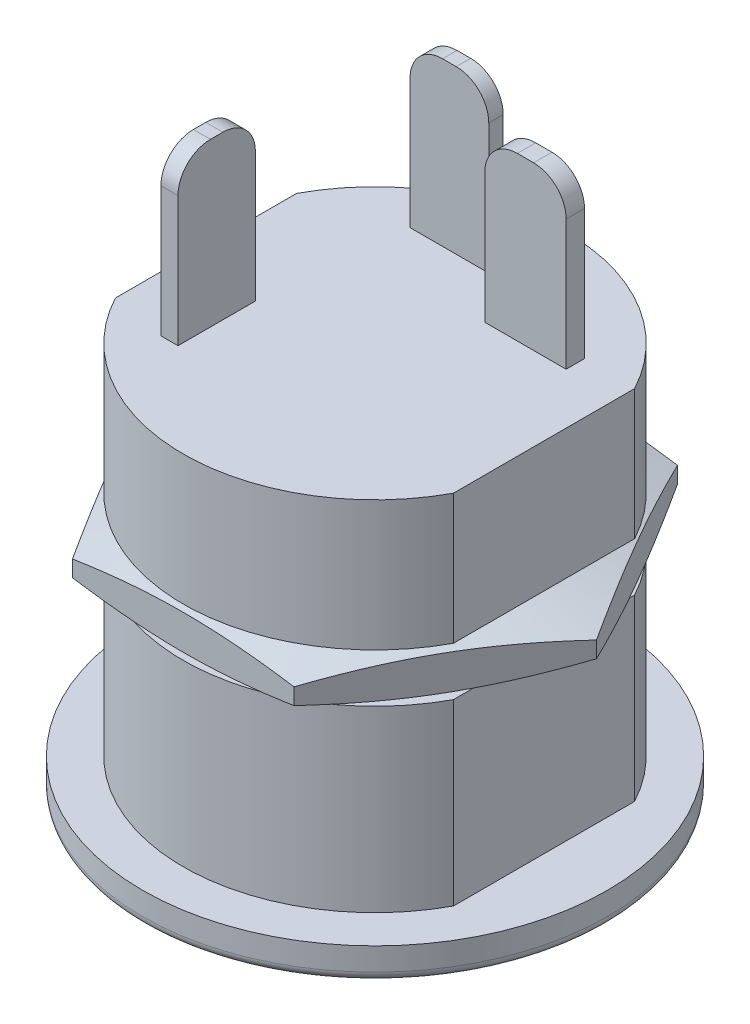
from build123d import *

# Parameters (mm, degrees)
SKETCH_2_R          = 5.9
EXTRUDE_1_DEPTH     = 11
SKETCH_3_R          = 7.15
EXTRUDE_2_DEPTH     = 1
SKETCH_4_R          = 3.1
SKETCH_4_R_2        = 0.5
CUT_EXTRUDE_1_DEPTH = 5
FILLET_1_R          = 0.3
FILLET_2_R          = 0.3
SKETCH_5_W          = 16.4
SKETCH_5_H          = 21
SKETCH_5_W_2        = 10.4
SKETCH_5_H_2        = 15
CUT_EXTRUDE_2_DEPTH = 11
SKETCH_6_W          = 2.420538387
SKETCH_6_H          = 0.443765371
SKETCH_6_W_2        = 2.501222999
SKETCH_6_H_2        = 0.56479229
SKETCH_6_W_3        = 0.524449984
SKETCH_6_H_3        = 2.38019608
EXTRUDE_3_DEPTH     = 5
FILLET_3_R          = 1
EXTRUDE_START       = -4
EXTRUDE_4_DEPTH     = 1.5


with BuildPart() as part:
    # 草图2 → 凸台-拉伸1 (new body)
    with BuildSketch(Plane(origin=(0, 0, 0), x_dir=(1, 0, 0), z_dir=(0, 1, 0))):
        with Locations(Location((0, 0, 0), (0, 0, 270))):
            Circle(SKETCH_2_R)
    extrude(amount=EXTRUDE_1_DEPTH)

    # 草图3 → 凸台-拉伸2 (add)
    with BuildSketch(Plane.XZ):
        with Locations(Location((0, 0, 0), (0, 0, 270))):
            Circle(SKETCH_3_R)
    extrude(amount=EXTRUDE_2_DEPTH)

    # 草图4 → 切除-拉伸1 (cut)
    with BuildSketch(Plane.XZ.offset(1)):
        with Locations(Location((0, 2.5, 0), (0, 0, 270))):
            Circle(SKETCH_4_R)
        with Locations(Location((0, 2.5, 0), (0, 0, 270))):
            Circle(SKETCH_4_R_2, mode=Mode.SUBTRACT)
    extrude(amount=-CUT_EXTRUDE_1_DEPTH, mode=Mode.SUBTRACT)

    # 圆角1
    fillet_1_edges = [part.edges().sort_by_distance(p)[0] for p in [
        (0, -1, 3),
    ]]
    fillet(fillet_1_edges, radius=FILLET_1_R)

    # 圆角2
    fillet_2_edges = [part.edges().sort_by_distance(p)[0] for p in [
        (0, -1, 7.15),
    ]]
    fillet(fillet_2_edges, radius=FILLET_2_R)

    # 草图5 → 切除-拉伸2 (cut)
    with BuildSketch(Plane(origin=(0, 11, 0), x_dir=(1, 0, 0), z_dir=(0, 1, 0))):
        Rectangle(SKETCH_5_W, SKETCH_5_H)
        Rectangle(SKETCH_5_W_2, SKETCH_5_H_2, mode=Mode.SUBTRACT)
    extrude(amount=-CUT_EXTRUDE_2_DEPTH, mode=Mode.SUBTRACT)

    # 草图6 → 凸台-拉伸3 (add)
    with BuildSketch(Plane(origin=(0, 11, 0), x_dir=(1, 0, 0), z_dir=(0, 1, 0))):
        with Locations((-1.331296113, 3.842604689)):
            Rectangle(SKETCH_6_W, SKETCH_6_H)
        with Locations((2.38019608, 2.531479729)):
            Rectangle(SKETCH_6_W_2, SKETCH_6_H_2)
        with Locations((-3.227384515, -1.906173979)):
            Rectangle(SKETCH_6_W_3, SKETCH_6_H_3)
    extrude(amount=EXTRUDE_3_DEPTH)

    # 圆角3
    fillet_3_edges = [part.edges().sort_by_distance(p)[0] for p in [
        (-0.121026919, 16, -3.842604688),
        (-2.541565306, 16, -3.842604688),
        (3.630807579, 16, -2.531479729),
        (1.12958458, 16, -2.531479729),
        (-3.227384515, 16, 0.716075939),
        (-3.227384515, 16, 3.096272019),
    ]]
    fillet(fillet_3_edges, radius=FILLET_3_R)

    # 草图7 → 凸台-拉伸4 (add)
    with BuildSketch(Plane(origin=(0, 11, 0), x_dir=(1, 0, 0), z_dir=(0, 1, 0)).offset(EXTRUDE_START)):
        Polygon((-3.406366588, 5.9), (-6.812733176, 0), (-3.406366588, -5.9), (3.406366588, -5.9), (6.812733176, 0), (3.406366588, 5.9), align=None)
    extrude(amount=-EXTRUDE_4_DEPTH)

    # 草图8 → 切除-旋转1 (revolve, cut)
    with BuildSketch(Plane.XY, mode=Mode.PRIVATE) as cut_revolve_1_sk:
        Polygon((-6.812733176, 7), (-6.812733176, 6.5), (-5.2, 7), align=None)
        Polygon((-5.2, 5.5), (-6.812733176, 5.5), (-6.812733176, 6), align=None)
    revolve(cut_revolve_1_sk.sketch.rotate(Axis((0, 11, 0), (0, -1, 0)), 180.000000014), axis=Axis((0, 11, 0), (0, -1, 0)), mode=Mode.SUBTRACT)


solid = part.part
